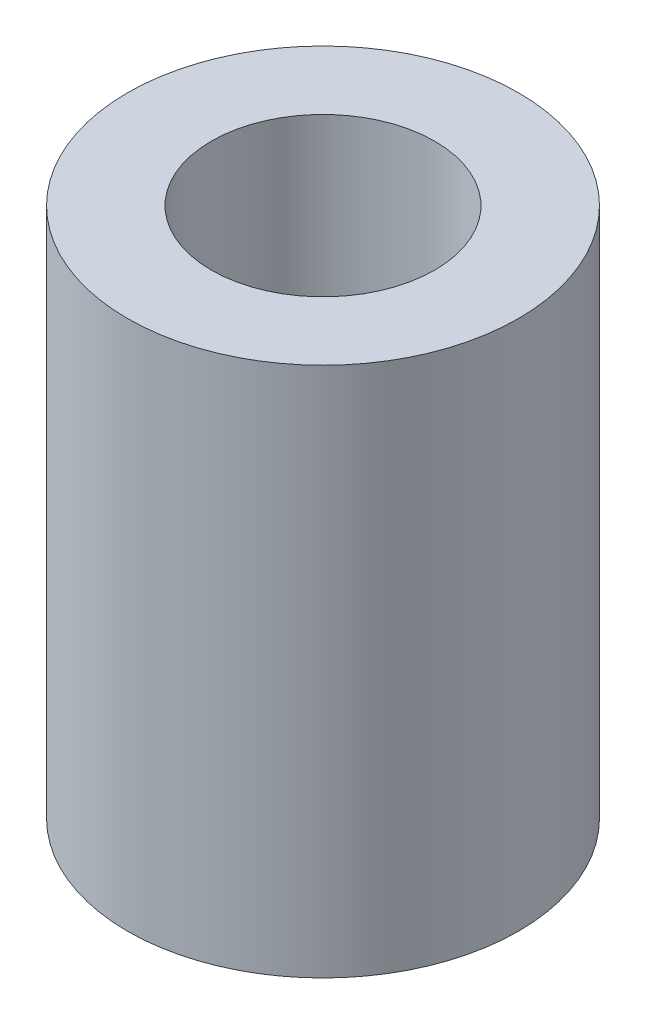
from build123d import *

# Parameters (mm, degrees)
SKETCH1_R           = 3.5
SKETCH1_R_2         = 2
BOSS_EXTRUDE1_DEPTH = 9.5


with BuildPart() as part:
    # Sketch1 → Boss-Extrude1 (new body)
    with BuildSketch(Plane(origin=(0, 0, 0), x_dir=(1, 0, 0), z_dir=(0, 1, 0))):
        with Locations(Location((0, 0, 0), (0, 0, 270))):
            Circle(SKETCH1_R)
        with Locations(Location((0, 0, 0), (0, 0, 270))):
            Circle(SKETCH1_R_2, mode=Mode.SUBTRACT)
    extrude(amount=BOSS_EXTRUDE1_DEPTH)


solid = part.part
